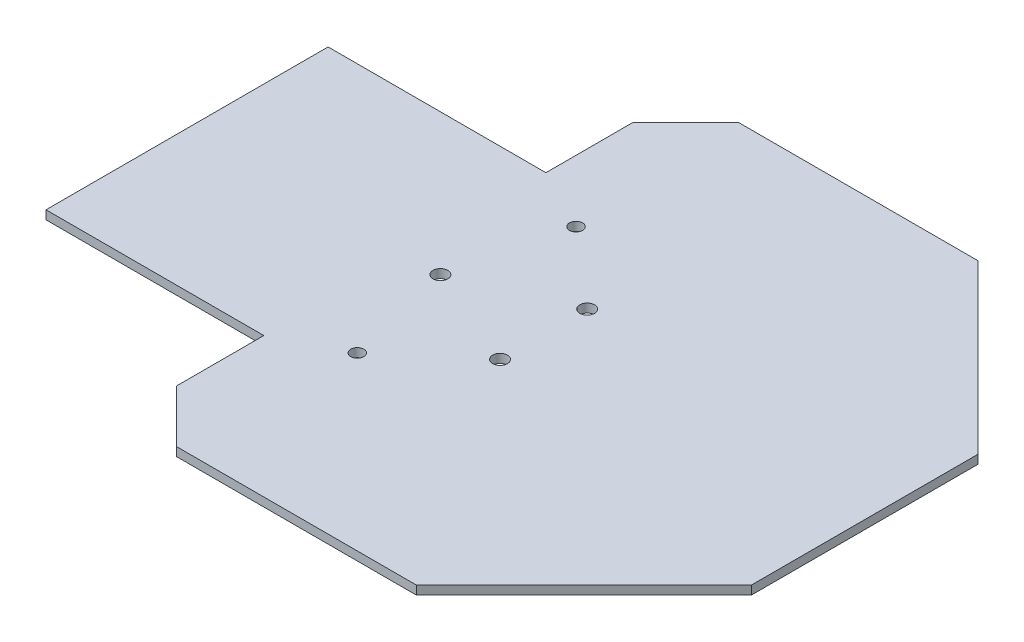
from build123d import *

# Parameters (mm, degrees)
BOSS_EXTRUDE1_DEPTH = 2
SKETCH2_R           = 1.7
CUT_EXTRUDE1_DEPTH  = 167.639739727
CUT_EXTRUDE2_REACH  = 168.64
SKETCH7_R           = 1.5
SKETCH10_W          = 64.75
SKETCH10_H          = 2
BOSS_EXTRUDE3_DEPTH = 50


with BuildPart() as part:
    # Sketch1 → Boss-Extrude1 (new body)
    with BuildSketch(Plane(origin=(0, 0, 0), x_dir=(1, 0, 0), z_dir=(0, 1, 0))):
        Polygon((0, 12.09), (0, 116.84), (12.09, 128.93), (67.09, 128.93), (105.554999675, 90.46), (105.554999675, 38.46), (67.09, 0), (12.09, 0), align=None)
    extrude(amount=BOSS_EXTRUDE1_DEPTH)

    # Sketch2 → Cut-Extrude1 (cut, through all)
    with BuildSketch(Plane(origin=(0, 2, 0), x_dir=(1, 0, 0), z_dir=(0, 1, 0))):
        with Locations(Location((8.15, 64.465, 0), (0, 0, 270))):
            Circle(SKETCH2_R)
        with Locations(Location((31.85, 54.465, 0), (0, 0, 270))):
            Circle(SKETCH2_R)
        with Locations(Location((31.85, 74.465, 0), (0, 0, 270))):
            Circle(SKETCH2_R)
    extrude(amount=-CUT_EXTRUDE1_DEPTH, mode=Mode.SUBTRACT)

    # Sketch7 → Cut-Extrude2 (cut, up to next)
    with BuildSketch(Plane(origin=(0, 2, 0), x_dir=(1, 0, 0), z_dir=(0, 1, 0)), mode=Mode.PRIVATE) as cut_extrude2_sk1:
        with Locations(Location((14.18, 89.57, 0), (0, 0, 270))):
            Circle(SKETCH7_R)
    cut_extrude2_tool1 = extrude(cut_extrude2_sk1.sketch, amount=-CUT_EXTRUDE2_REACH, mode=Mode.PRIVATE) & part.part
    # Sketch7 → Cut-Extrude2 (cut, up to next)
    with BuildSketch(Plane(origin=(0, 2, 0), x_dir=(1, 0, 0), z_dir=(0, 1, 0)), mode=Mode.PRIVATE) as cut_extrude2_sk2:
        with Locations(Location((14.177621555, 39.358656737, 0), (0, 0, 90))):
            Circle(SKETCH7_R)
    cut_extrude2_tool2 = extrude(cut_extrude2_sk2.sketch, amount=-CUT_EXTRUDE2_REACH, mode=Mode.PRIVATE) & part.part
    add(cut_extrude2_tool1.solids().sort_by_distance((14.18, 2, -89.57))[0], mode=Mode.SUBTRACT)
    add(cut_extrude2_tool2.solids().sort_by_distance((14.177622, 2, -39.358657))[0], mode=Mode.SUBTRACT)

    # Sketch10 → Boss-Extrude3 (add)
    with BuildSketch(Plane.ZY):
        with Locations((-64.465, 1)):
            Rectangle(SKETCH10_W, SKETCH10_H)
    extrude(amount=BOSS_EXTRUDE3_DEPTH)


solid = part.part
